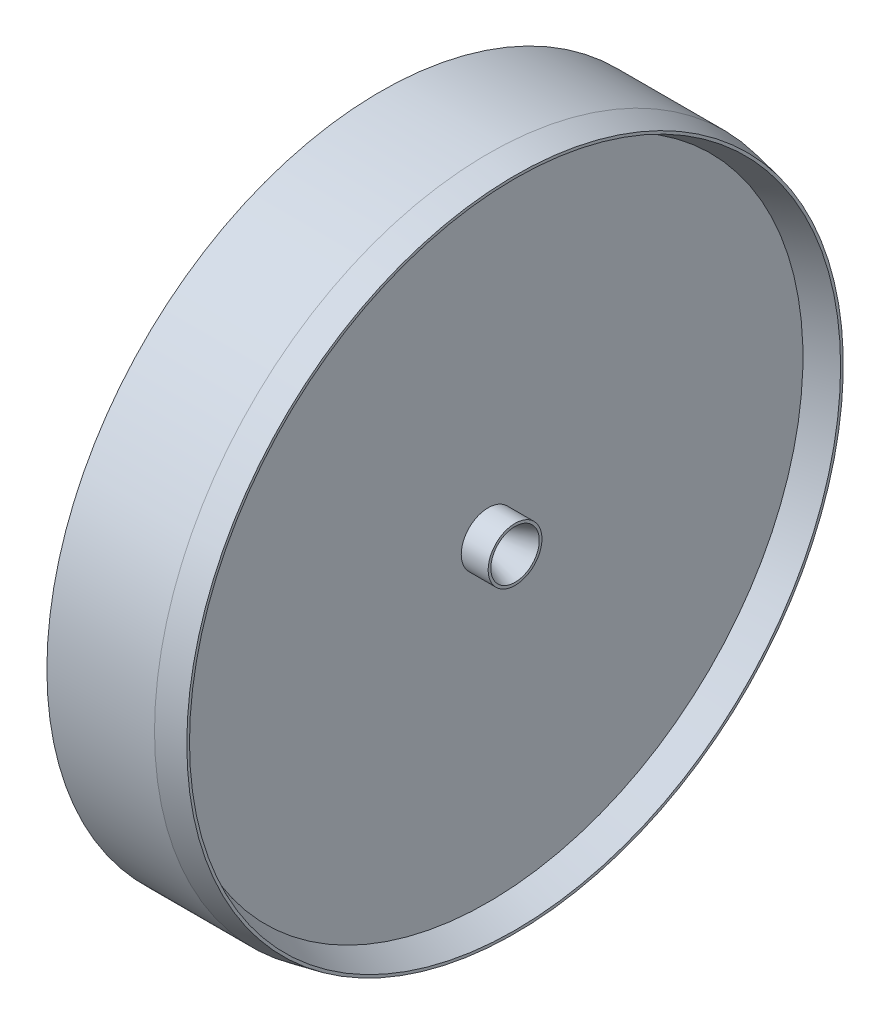
from build123d import *


with BuildPart() as part:
    # Szkic1 → Obrót1 (revolve)
    with BuildSketch(Plane.XY, mode=Mode.PRIVATE) as obr_t1_sk:
        Polygon((0, 12.4), (0, 0), (4, 0), (4, 0.5), (5, 0.9), (5, 1), (4, 1), (4, 11.7), (5, 12.1), (5, 12.2), (4, 12.4), align=None)
    revolve(obr_t1_sk.sketch.rotate(Axis((0, 0, 0), (1, 0, 0)), 90), axis=Axis((0, 0, 0), (1, 0, 0)))


solid = part.part
